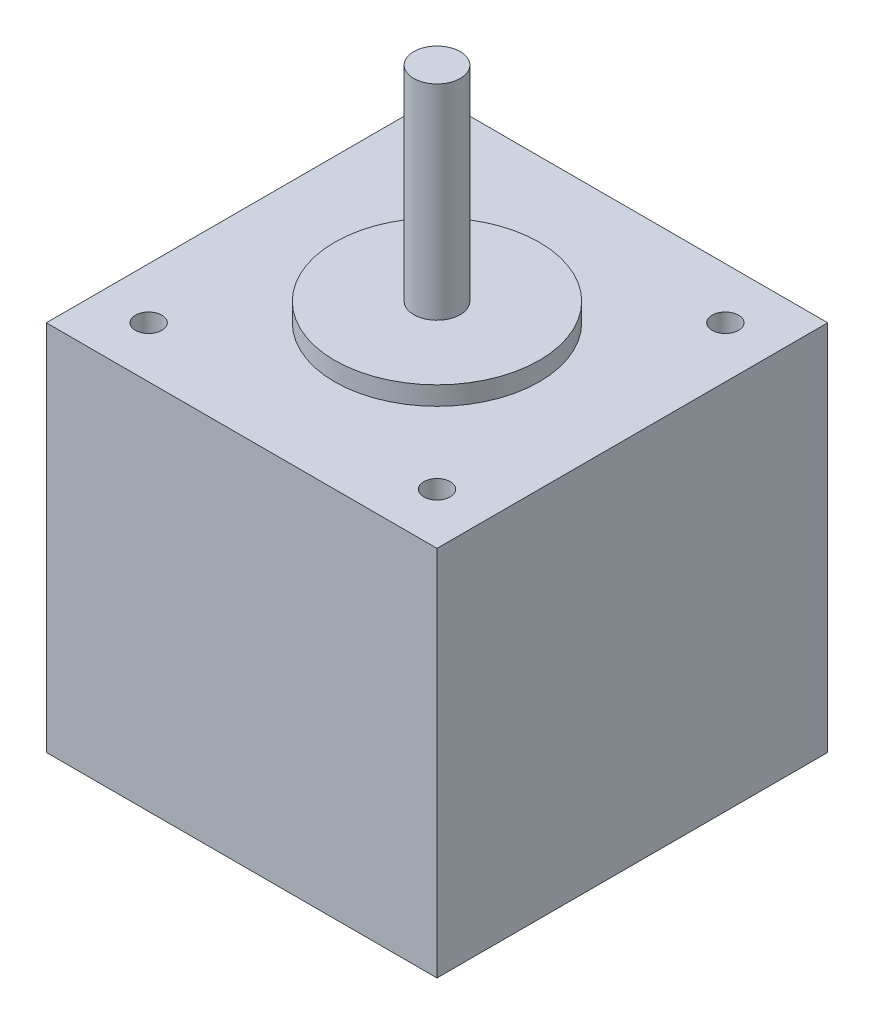
from build123d import *

# Parameters (mm, degrees)
SKETCH1_W           = 42
SKETCH1_H           = 42
BOSS_EXTRUDE1_DEPTH = 40
SKETCH2_R           = 11
BOSS_EXTRUDE2_DEPTH = 2
SKETCH3_R           = 2.5
BOSS_EXTRUDE3_DEPTH = 22
SKETCH4_R           = 1.42
CUT_EXTRUDE1_DEPTH  = 5


with BuildPart() as part:
    # Sketch1 → Boss-Extrude1 (new body)
    with BuildSketch(Plane(origin=(0, 0, 0), x_dir=(1, 0, 0), z_dir=(0, 1, 0))):
        Rectangle(SKETCH1_W, SKETCH1_H)
    extrude(amount=BOSS_EXTRUDE1_DEPTH)

    # Sketch2 → Boss-Extrude2 (add)
    with BuildSketch(Plane(origin=(0, 40, 0), x_dir=(1, 0, 0), z_dir=(0, 1, 0))):
        with Locations(Location((0, 0, 0), (0, 0, 90))):
            Circle(SKETCH2_R)
    extrude(amount=BOSS_EXTRUDE2_DEPTH)

    # Sketch3 → Boss-Extrude3 (add)
    with BuildSketch(Plane(origin=(0, 42, 0), x_dir=(1, 0, 0), z_dir=(0, 1, 0))):
        with Locations(Location((0, 0, 0), (0, 0, 270))):
            Circle(SKETCH3_R)
    extrude(amount=BOSS_EXTRUDE3_DEPTH)

    # Sketch4 → Cut-Extrude1 (cut)
    with BuildSketch(Plane(origin=(0, 40, 0), x_dir=(1, 0, 0), z_dir=(0, 1, 0))):
        with Locations(Location((-15.5, 15.5, 0), (0, 0, 270))):
            Circle(SKETCH4_R)
        with Locations(Location((15.5, 15.5, 0), (0, 0, 270))):
            Circle(SKETCH4_R)
        with Locations(Location((15.5, -15.5, 0), (0, 0, 270))):
            Circle(SKETCH4_R)
        with Locations(Location((-15.5, -15.5, 0), (0, 0, 270))):
            Circle(SKETCH4_R)
    extrude(amount=-CUT_EXTRUDE1_DEPTH, mode=Mode.SUBTRACT)


solid = part.part
